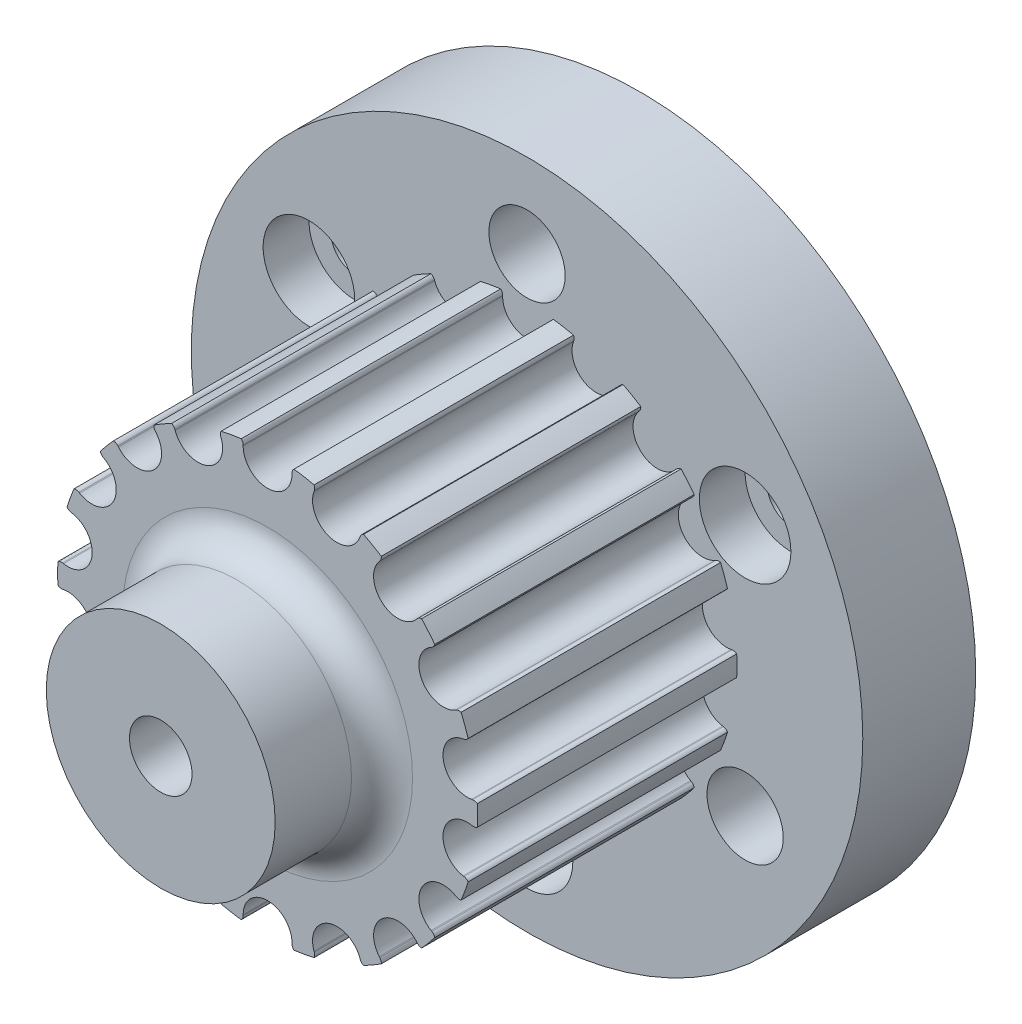
from build123d import *

# Parameters (mm, degrees)
BOSS_EXTRUDE1_DEPTH = 24.4
SKETCH1_R           = 22
SKETCH1_R_2         = 2.5
SKETCH1_R_3         = 1.55
BOSS_EXTRUDE2_DEPTH = 7.4
SKETCH4_R           = 3
CUT_EXTRUDE1_DEPTH  = 3
SKETCH5_R           = 7.5
BOSS_EXTRUDE3_DEPTH = 7
FILLET1_R           = 2
SKETCH6_R           = 2.05
CUT_EXTRUDE2_DEPTH  = 8


with BuildPart() as part:
    # Sketch3 → Boss-Extrude1 (new body)
    with BuildSketch(Plane.XY):
        with BuildLine():
            Line((3.064170821, 13.09682718), (3.043649612, 13.040445623))
            ThreePointArc((3.043649612, 13.040445623), (3.999925576, 10.9897052), (6.050665999, 11.945981164))
            Line((6.050665999, 11.945981164), (6.071187207, 12.002362721))
            ThreePointArc((6.071187207, 12.002362721), (6.156288234, 12.140235033), (6.289096445, 12.233040951))
            ThreePointArc((6.289096445, 12.233040951), (6.8775, 11.912179429), (7.449576006, 11.563037764))
            ThreePointArc((7.449576006, 11.563037764), (7.43560783, 11.401619521), (7.358757418, 11.258983713))
            Line((7.358757418, 11.258983713), (7.320190162, 11.213021047))
            ThreePointArc((7.320190162, 11.213021047), (7.517401095, 8.958889762), (9.77153238, 9.156100696))
            Line((9.77153238, 9.156100696), (9.810099636, 9.202063362))
            ThreePointArc((9.810099636, 9.202063362), (9.937223551, 9.302514691), (10.09376394, 9.344300643))
            ThreePointArc((10.09376394, 9.344300643), (10.536941315, 8.841543571), (10.955103434, 8.317796207))
            ThreePointArc((10.955103434, 8.317796207), (10.886769351, 8.170890073), (10.765769268, 8.063140646))
            Line((10.765769268, 8.063140646), (10.713807743, 8.033140646))
            ThreePointArc((10.713807743, 8.033140646), (10.128167097, 5.8475), (12.313807743, 5.261859354))
            Line((12.313807743, 5.261859354), (12.365769268, 5.291859354))
            ThreePointArc((12.365769268, 5.291859354), (12.51958305, 5.342773787), (12.680974536, 5.328499771))
            ThreePointArc((12.680974536, 5.328499771), (12.925471999, 4.704487071), (13.139283708, 4.06930567))
            ThreePointArc((13.139283708, 4.06930567), (13.024825817, 3.954630693), (12.874270457, 3.894763818))
            Line((12.874270457, 3.894763818), (12.815181992, 3.884344927))
            ThreePointArc((12.815181992, 3.884344927), (11.517326671, 2.030815438), (13.370856161, 0.732960117))
            Line((13.370856161, 0.732960117), (13.429944626, 0.743379008))
            ThreePointArc((13.429944626, 0.743379008), (13.591896064, 0.738615513), (13.738672452, 0.670003187))
            ThreePointArc((13.738672452, 0.670003187), (13.755, 0), (13.738672452, -0.670003187))
            ThreePointArc((13.738672452, -0.670003187), (13.591896064, -0.738615513), (13.429944626, -0.743379008))
            Line((13.429944626, -0.743379008), (13.370856161, -0.732960117))
            ThreePointArc((13.370856161, -0.732960117), (11.517326671, -2.030815438), (12.815181992, -3.884344927))
            Line((12.815181992, -3.884344927), (12.874270457, -3.894763818))
            ThreePointArc((12.874270457, -3.894763818), (13.024825817, -3.954630693), (13.139283708, -4.06930567))
            ThreePointArc((13.139283708, -4.06930567), (12.925471999, -4.704487071), (12.680974536, -5.328499771))
            ThreePointArc((12.680974536, -5.328499771), (12.51958305, -5.342773787), (12.365769268, -5.291859354))
            Line((12.365769268, -5.291859354), (12.313807743, -5.261859354))
            ThreePointArc((12.313807743, -5.261859354), (10.128167097, -5.8475), (10.713807743, -8.033140646))
            Line((10.713807743, -8.033140646), (10.765769268, -8.063140646))
            ThreePointArc((10.765769268, -8.063140646), (10.886769351, -8.170890073), (10.955103434, -8.317796207))
            ThreePointArc((10.955103434, -8.317796207), (10.536941315, -8.841543571), (10.09376394, -9.344300643))
            ThreePointArc((10.09376394, -9.344300643), (9.937223551, -9.302514691), (9.810099636, -9.202063362))
            Line((9.810099636, -9.202063362), (9.77153238, -9.156100696))
            ThreePointArc((9.77153238, -9.156100696), (7.517401095, -8.958889762), (7.320190162, -11.213021047))
            Line((7.320190162, -11.213021047), (7.358757418, -11.258983713))
            ThreePointArc((7.358757418, -11.258983713), (7.43560783, -11.401619521), (7.449576006, -11.563037764))
            ThreePointArc((7.449576006, -11.563037764), (6.8775, -11.912179429), (6.289096445, -12.233040951))
            ThreePointArc((6.289096445, -12.233040951), (6.156288234, -12.140235033), (6.071187207, -12.002362721))
            Line((6.071187207, -12.002362721), (6.050665999, -11.945981164))
            ThreePointArc((6.050665999, -11.945981164), (3.999925576, -10.9897052), (3.043649612, -13.040445623))
            Line((3.043649612, -13.040445623), (3.064170821, -13.09682718))
            ThreePointArc((3.064170821, -13.09682718), (3.087602266, -13.257145384), (3.045519768, -13.413606314))
            ThreePointArc((3.045519768, -13.413606314), (2.388530684, -13.546030643), (1.725871102, -13.646295979))
            ThreePointArc((1.725871102, -13.646295979), (1.632813699, -13.51366386), (1.6, -13.355))
            Line((1.6, -13.355), (1.6, -13.295))
            ThreePointArc((1.6, -13.295), (0, -11.695), (-1.6, -13.295))
            Line((-1.6, -13.295), (-1.6, -13.355))
            ThreePointArc((-1.6, -13.355), (-1.632813699, -13.51366386), (-1.725871102, -13.646295979))
            ThreePointArc((-1.725871102, -13.646295979), (-2.388530684, -13.546030643), (-3.045519768, -13.413606314))
            ThreePointArc((-3.045519768, -13.413606314), (-3.087602266, -13.257145384), (-3.064170821, -13.09682718))
            Line((-3.064170821, -13.09682718), (-3.043649612, -13.040445623))
            ThreePointArc((-3.043649612, -13.040445623), (-3.999925576, -10.9897052), (-6.050665999, -11.945981164))
            Line((-6.050665999, -11.945981164), (-6.071187207, -12.002362721))
            ThreePointArc((-6.071187207, -12.002362721), (-6.156288234, -12.140235033), (-6.289096445, -12.233040951))
            ThreePointArc((-6.289096445, -12.233040951), (-6.8775, -11.912179429), (-7.449576006, -11.563037764))
            ThreePointArc((-7.449576006, -11.563037764), (-7.43560783, -11.401619521), (-7.358757418, -11.258983713))
            Line((-7.358757418, -11.258983713), (-7.320190162, -11.213021047))
            ThreePointArc((-7.320190162, -11.213021047), (-7.517401095, -8.958889762), (-9.77153238, -9.156100696))
            Line((-9.77153238, -9.156100696), (-9.810099636, -9.202063362))
            ThreePointArc((-9.810099636, -9.202063362), (-9.937223551, -9.302514691), (-10.09376394, -9.344300643))
            ThreePointArc((-10.09376394, -9.344300643), (-10.536941315, -8.841543571), (-10.955103434, -8.317796207))
            ThreePointArc((-10.955103434, -8.317796207), (-10.886769351, -8.170890073), (-10.765769268, -8.063140646))
            Line((-10.765769268, -8.063140646), (-10.713807743, -8.033140646))
            ThreePointArc((-10.713807743, -8.033140646), (-10.128167097, -5.8475), (-12.313807743, -5.261859354))
            Line((-12.313807743, -5.261859354), (-12.365769268, -5.291859354))
            ThreePointArc((-12.365769268, -5.291859354), (-12.51958305, -5.342773787), (-12.680974536, -5.328499771))
            ThreePointArc((-12.680974536, -5.328499771), (-12.925471999, -4.704487071), (-13.139283708, -4.06930567))
            ThreePointArc((-13.139283708, -4.06930567), (-13.024825817, -3.954630693), (-12.874270457, -3.894763818))
            Line((-12.874270457, -3.894763818), (-12.815181992, -3.884344927))
            ThreePointArc((-12.815181992, -3.884344927), (-11.517326671, -2.030815438), (-13.370856161, -0.732960117))
            Line((-13.370856161, -0.732960117), (-13.429944626, -0.743379008))
            ThreePointArc((-13.429944626, -0.743379008), (-13.591896064, -0.738615513), (-13.738672452, -0.670003187))
            ThreePointArc((-13.738672452, -0.670003187), (-13.755, 0), (-13.738672452, 0.670003187))
            ThreePointArc((-13.738672452, 0.670003187), (-13.591896064, 0.738615513), (-13.429944626, 0.743379008))
            Line((-13.429944626, 0.743379008), (-13.370856161, 0.732960117))
            ThreePointArc((-13.370856161, 0.732960117), (-11.517326671, 2.030815438), (-12.815181992, 3.884344927))
            Line((-12.815181992, 3.884344927), (-12.874270457, 3.894763818))
            ThreePointArc((-12.874270457, 3.894763818), (-13.024825817, 3.954630693), (-13.139283708, 4.06930567))
            ThreePointArc((-13.139283708, 4.06930567), (-12.925471999, 4.704487071), (-12.680974536, 5.328499771))
            ThreePointArc((-12.680974536, 5.328499771), (-12.51958305, 5.342773787), (-12.365769268, 5.291859354))
            Line((-12.365769268, 5.291859354), (-12.313807743, 5.261859354))
            ThreePointArc((-12.313807743, 5.261859354), (-10.128167097, 5.8475), (-10.713807743, 8.033140646))
            Line((-10.713807743, 8.033140646), (-10.765769268, 8.063140646))
            ThreePointArc((-10.765769268, 8.063140646), (-10.886769351, 8.170890073), (-10.955103434, 8.317796207))
            ThreePointArc((-10.955103434, 8.317796207), (-10.536941315, 8.841543571), (-10.09376394, 9.344300643))
            ThreePointArc((-10.09376394, 9.344300643), (-9.937223551, 9.302514691), (-9.810099636, 9.202063362))
            Line((-9.810099636, 9.202063362), (-9.77153238, 9.156100696))
            ThreePointArc((-9.77153238, 9.156100696), (-7.517401095, 8.958889762), (-7.320190162, 11.213021047))
            Line((-7.320190162, 11.213021047), (-7.358757418, 11.258983713))
            ThreePointArc((-7.358757418, 11.258983713), (-7.43560783, 11.401619521), (-7.449576006, 11.563037764))
            ThreePointArc((-7.449576006, 11.563037764), (-6.8775, 11.912179429), (-6.289096445, 12.233040951))
            ThreePointArc((-6.289096445, 12.233040951), (-6.156288234, 12.140235033), (-6.071187207, 12.002362721))
            Line((-6.071187207, 12.002362721), (-6.050665999, 11.945981164))
            ThreePointArc((-6.050665999, 11.945981164), (-3.999925576, 10.9897052), (-3.043649612, 13.040445623))
            Line((-3.043649612, 13.040445623), (-3.064170821, 13.09682718))
            ThreePointArc((-3.064170821, 13.09682718), (-3.087602266, 13.257145384), (-3.045519768, 13.413606314))
            ThreePointArc((-3.045519768, 13.413606314), (-2.388530684, 13.546030643), (-1.725871102, 13.646295979))
            ThreePointArc((-1.725871102, 13.646295979), (-1.632813699, 13.51366386), (-1.6, 13.355))
            Line((-1.6, 13.355), (-1.6, 13.295))
            ThreePointArc((-1.6, 13.295), (0, 11.695), (1.6, 13.295))
            Line((1.6, 13.295), (1.6, 13.355))
            ThreePointArc((1.6, 13.355), (1.632813699, 13.51366386), (1.725871102, 13.646295979))
            ThreePointArc((1.725871102, 13.646295979), (2.388530684, 13.546030643), (3.045519768, 13.413606314))
            ThreePointArc((3.045519768, 13.413606314), (3.087602266, 13.257145384), (3.064170821, 13.09682718))
        make_face()
    extrude(amount=BOSS_EXTRUDE1_DEPTH)

    # Sketch1 → Boss-Extrude2 (add)
    with BuildSketch(Plane.XY):
        Circle(SKETCH1_R)
        with Locations((0, 16.5)):
            Circle(SKETCH1_R_2, mode=Mode.SUBTRACT)
        with Locations((14.289419162, -8.25)):
            Circle(SKETCH1_R_2, mode=Mode.SUBTRACT)
        with Locations((-14.289419162, -8.25)):
            Circle(SKETCH1_R_2, mode=Mode.SUBTRACT)
        with Locations((0, -16.5)):
            Circle(SKETCH1_R_3, mode=Mode.SUBTRACT)
        with Locations((-14.289419162, 8.25)):
            Circle(SKETCH1_R_3, mode=Mode.SUBTRACT)
        with Locations((14.289419162, 8.25)):
            Circle(SKETCH1_R_3, mode=Mode.SUBTRACT)
    extrude(amount=BOSS_EXTRUDE2_DEPTH)

    # Sketch4 → Cut-Extrude1 (cut)
    with BuildSketch(Plane.XY.offset(7.4)):
        with Locations((0, -16.5)):
            Circle(SKETCH4_R)
        with Locations((-14.289419162, 8.25)):
            Circle(SKETCH4_R)
        with Locations((14.289419162, 8.25)):
            Circle(SKETCH4_R)
    extrude(amount=-CUT_EXTRUDE1_DEPTH, mode=Mode.SUBTRACT)

    # Sketch5 → Boss-Extrude3 (add)
    with BuildSketch(Plane.XY.offset(24.4)):
        Circle(SKETCH5_R)
    extrude(amount=BOSS_EXTRUDE3_DEPTH)

    # Fillet1
    fillet1_edges = [part.edges().sort_by_distance(p)[0] for p in [
        (-7.5, 0, 24.4),
    ]]
    fillet(fillet1_edges, radius=FILLET1_R)

    # Sketch6 → Cut-Extrude2 (cut)
    with BuildSketch(Plane.XY.offset(31.4)):
        Circle(SKETCH6_R)
    extrude(amount=-CUT_EXTRUDE2_DEPTH, mode=Mode.SUBTRACT)


solid = part.part
